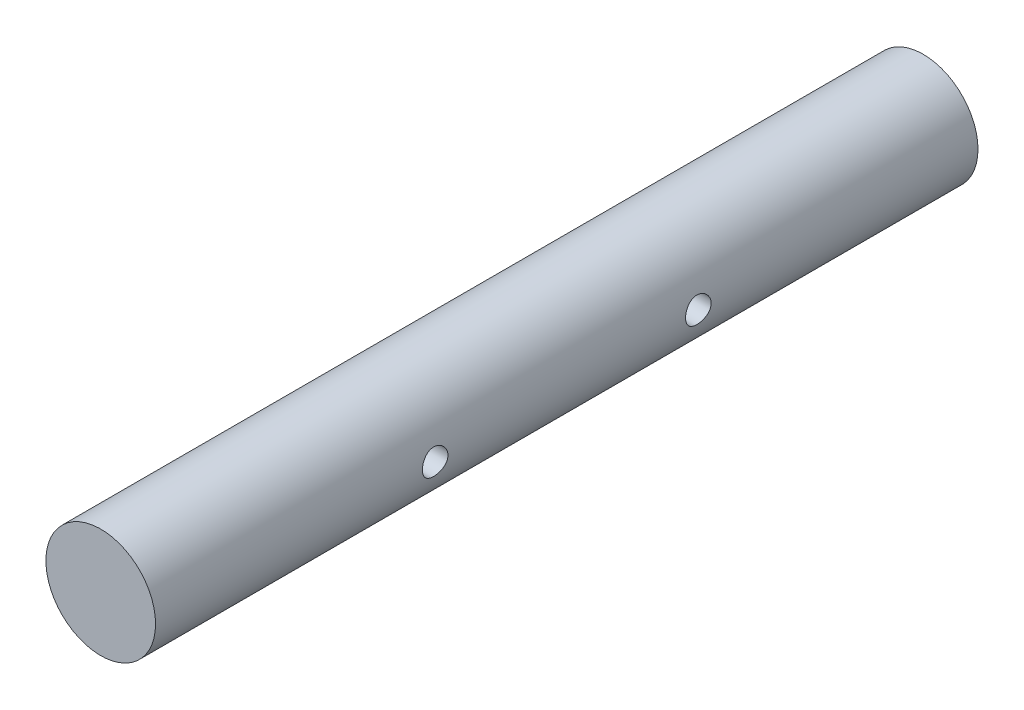
from build123d import *

# Parameters (mm, degrees)
SKETCH1_R               = 30
BOSS_EXTRUDE1_DEPTH     = 225
CUT_EXTRUDE1_DEPTH      = 229.965062837
CUT_EXTRUDE1_DEPTH_BACK = 229.965062837
SKETCH2_R               = 7


with BuildPart() as part:
    # Sketch1 → Boss-Extrude1 (new, symmetric)
    with BuildSketch(Plane.XY):
        Circle(SKETCH1_R)
    extrude(amount=BOSS_EXTRUDE1_DEPTH, both=True)

    # Sketch2 → Cut-Extrude1 (cut, two sides: drawn at the far end of the back side and taken through both)
    with BuildSketch(Plane(origin=(0, 0, 0), x_dir=(0, 0, -1), z_dir=(1, 0, 0)).offset(-CUT_EXTRUDE1_DEPTH_BACK)):
        with Locations(Location((72, 0, 0), (0, 0, 180))):
            Circle(SKETCH2_R)
        with Locations(Location((-72, 0, 0), (0, 0, 180))):
            Circle(SKETCH2_R)
    extrude(amount=CUT_EXTRUDE1_DEPTH + CUT_EXTRUDE1_DEPTH_BACK, mode=Mode.SUBTRACT)


solid = part.part
